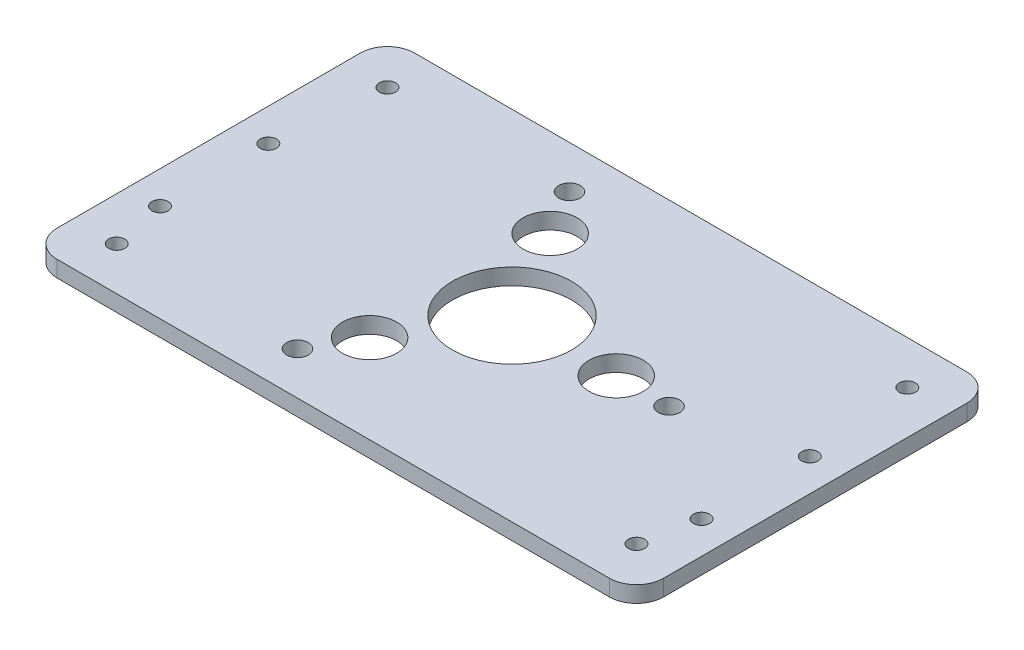
from build123d import *

# Parameters (mm, degrees)
SKETCH_1_W          = 112
SKETCH_1_H          = 66
SKETCH_1_R          = 1.5
SKETCH_1_R_2        = 2
SKETCH_1_R_3        = 11
SKETCH_1_R_4        = 5
EXTRUDE_1_DEPTH     = 3
FILLET_1_R          = 5
SKETCH_2_R          = 1.5
CUT_EXTRUDE_1_DEPTH = 10


with BuildPart() as part:
    # 草图1 → 凸台-拉伸1 (new body)
    with BuildSketch(Plane(origin=(0, 0, 0), x_dir=(1, 0, 0), z_dir=(0, 1, 0))):
        Rectangle(SKETCH_1_W, SKETCH_1_H)
        with Locations(Location((-50, 5, 0), (0, 0, 270))):
            Circle(SKETCH_1_R, mode=Mode.SUBTRACT)
        with Locations(Location((-50, -15, 0), (0, 0, 90))):
            Circle(SKETCH_1_R, mode=Mode.SUBTRACT)
        with Locations(Location((50, -15, 0), (0, 0, 270))):
            Circle(SKETCH_1_R, mode=Mode.SUBTRACT)
        with Locations(Location((50, 5, 0), (0, 0, 90))):
            Circle(SKETCH_1_R, mode=Mode.SUBTRACT)
        with Locations(Location((-14.5, 25.11473671, 0), (0, 0, 270))):
            Circle(SKETCH_1_R_2, mode=Mode.SUBTRACT)
        with Locations(Location((29, 0, 0), (0, 0, 270))):
            Circle(SKETCH_1_R_2, mode=Mode.SUBTRACT)
        with Locations(Location((-14.5, -25.11473671, 0), (0, 0, 270))):
            Circle(SKETCH_1_R_2, mode=Mode.SUBTRACT)
        with Locations(Location((0, 0, 0), (0, 0, 270))):
            Circle(SKETCH_1_R_3, mode=Mode.SUBTRACT)
        with Locations(Location((19.25, 0, 0), (0, 0, 270))):
            Circle(SKETCH_1_R_4, mode=Mode.SUBTRACT)
        with Locations(Location((-9.625, -16.670989023, 0), (0, 0, 270))):
            Circle(SKETCH_1_R_4, mode=Mode.SUBTRACT)
        with Locations(Location((-9.625, 16.670989023, 0), (0, 0, 270))):
            Circle(SKETCH_1_R_4, mode=Mode.SUBTRACT)
    extrude(amount=EXTRUDE_1_DEPTH)

    # 圆角1
    fillet_1_edges = [part.edges().sort_by_distance(p)[0] for p in [
        (56, 1.5, 33),
        (-56, 1.5, 33),
        (-56, 1.5, -33),
        (56, 1.5, -33),
    ]]
    fillet(fillet_1_edges, radius=FILLET_1_R)

    # 草图2 → 切除-拉伸1 (cut)
    with BuildSketch(Plane(origin=(0, 3, 0), x_dir=(1, 0, 0), z_dir=(0, 1, 0))):
        with Locations(Location((-48, 25, 0), (0, 0, 270))):
            Circle(SKETCH_2_R)
        with Locations(Location((-48, -25, 0), (0, 0, 270))):
            Circle(SKETCH_2_R)
        with Locations(Location((48, -25, 0), (0, 0, 270))):
            Circle(SKETCH_2_R)
        with Locations(Location((48, 25, 0), (0, 0, 270))):
            Circle(SKETCH_2_R)
    extrude(amount=-CUT_EXTRUDE_1_DEPTH, mode=Mode.SUBTRACT)


solid = part.part
